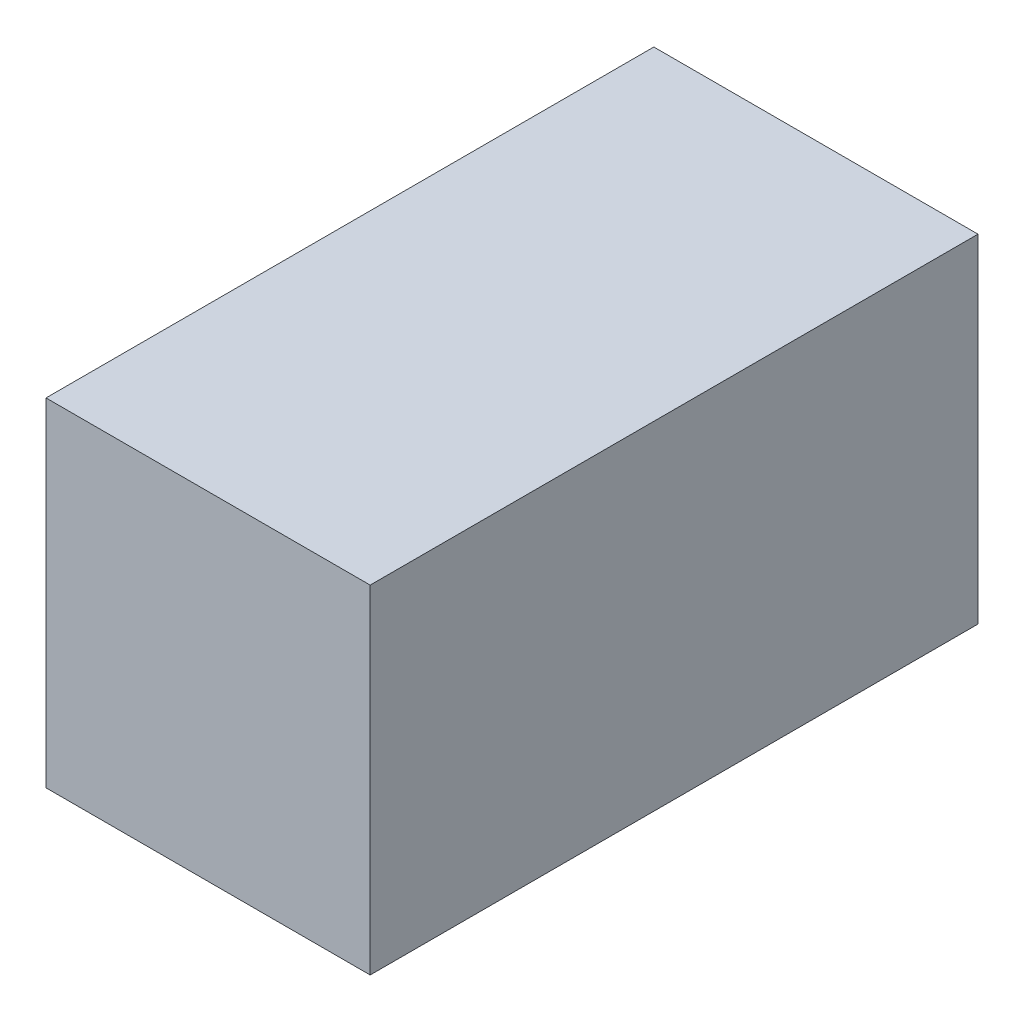
from build123d import *

# Parameters (mm, degrees)
SKETCH1_W           = 57.15
SKETCH1_H           = 31.75
BOSS_EXTRUDE1_DEPTH = 30.48


with BuildPart() as part:
    # Sketch1 → Boss-Extrude1 (new body)
    with BuildSketch(Plane(origin=(0, 0, 0), x_dir=(0, 0, -1), z_dir=(1, 0, 0))):
        with Locations((3.491063348, 4.743025836)):
            Rectangle(SKETCH1_W, SKETCH1_H)
    extrude(amount=BOSS_EXTRUDE1_DEPTH)


solid = part.part
